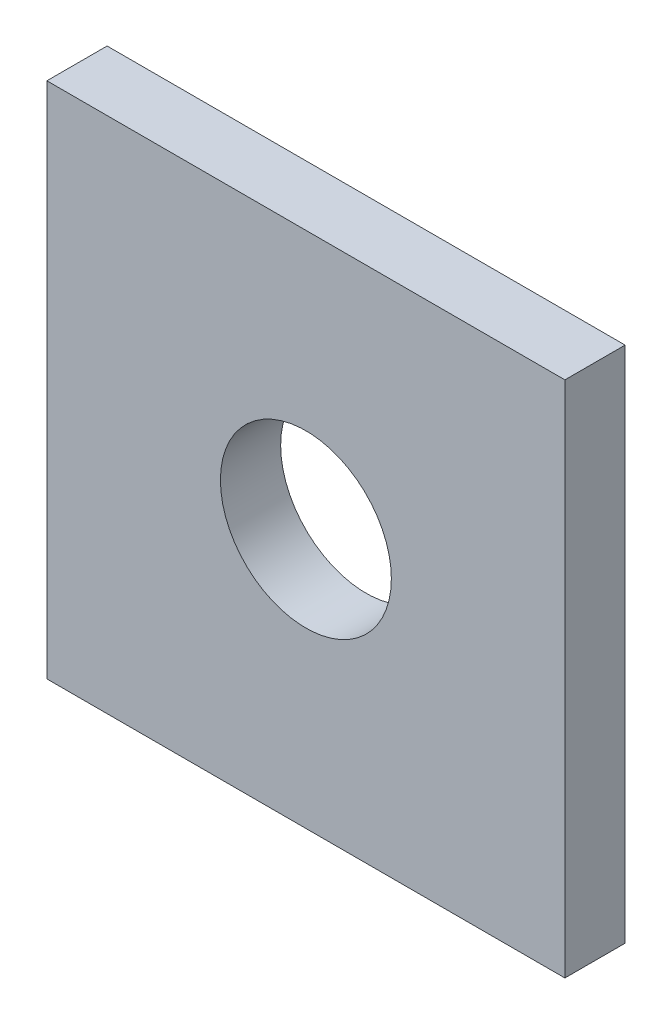
from build123d import *

# Parameters (mm, degrees)
CROQUIS1_W              = 86
CROQUIS1_H              = 86
CROQUIS1_R              = 14.189741596
SALIENTE_EXTRUIR1_DEPTH = 10


with BuildPart() as part:
    # Croquis1 → Saliente-Extruir1 (new body)
    with BuildSketch(Plane.XY):
        Rectangle(CROQUIS1_W, CROQUIS1_H)
        Circle(CROQUIS1_R, mode=Mode.SUBTRACT)
    extrude(amount=SALIENTE_EXTRUIR1_DEPTH)


solid = part.part
